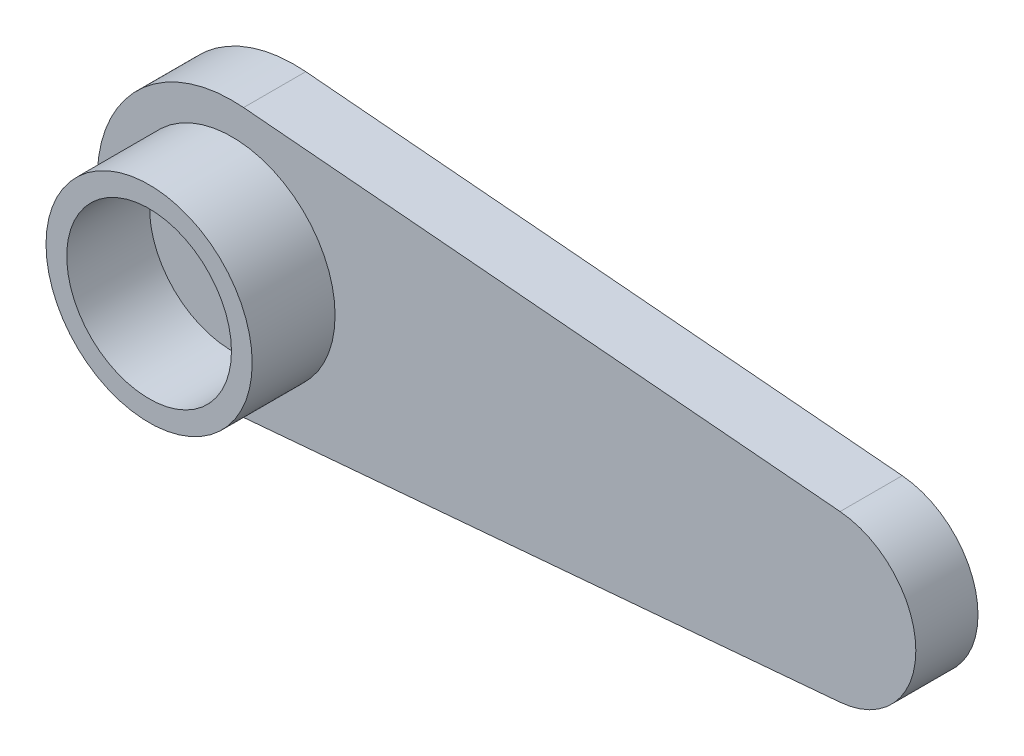
from build123d import *

# Parameters (mm, degrees)
BOSS_EXTRUDE1_DEPTH = 3
SKETCH2_R           = 4.975
SKETCH2_R_2         = 3.975
EXTRUDE_THIN1_DEPTH = 4


with BuildPart() as part:
    # Sketch1 → Boss-Extrude1 (new body)
    with BuildSketch(Plane.XY):
        with BuildLine():
            Line((-28.620254205, 6.475802165), (0.164228554, 3.985109024))
            ThreePointArc((0.164228554, 3.985109024), (3.819400968, 0), (0.164228554, -3.985109024))
            Line((0.164228554, -3.985109024), (-28.620254205, -6.475802165))
            ThreePointArc((-28.620254205, -6.475802165), (-35.680599032, 0), (-28.620254205, 6.475802165))
        make_face()
    extrude(amount=BOSS_EXTRUDE1_DEPTH)

    # Sketch2 → Extrude-Thin1 (add)
    with BuildSketch(Plane.XY.offset(3)):
        with Locations((-29.180599032, 0)):
            Circle(SKETCH2_R)
        with Locations((-29.180599032, 0)):
            Circle(SKETCH2_R_2, mode=Mode.SUBTRACT)
    extrude(amount=EXTRUDE_THIN1_DEPTH)


solid = part.part
